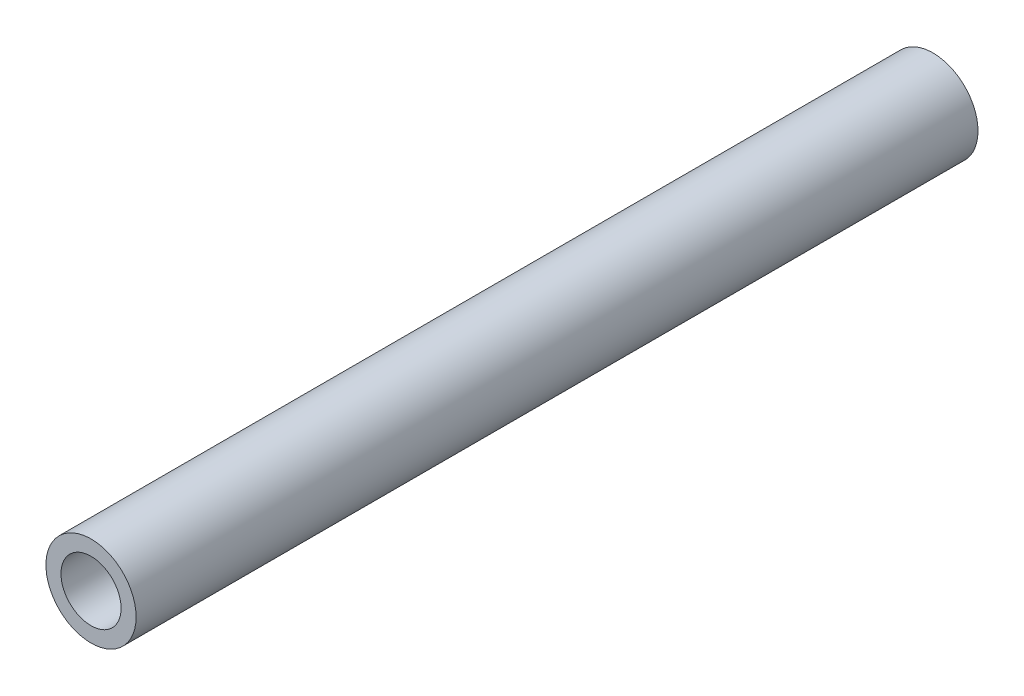
from build123d import *

# Parameters (mm, degrees)
SKETCH1_R           = 15
SKETCH1_R_2         = 10
BOSS_EXTRUDE1_DEPTH = 140


with BuildPart() as part:
    # Sketch1 → Boss-Extrude1 (new, symmetric)
    with BuildSketch(Plane(origin=(0, 0, 0), x_dir=(0, 1, 0), z_dir=(0, 0, 1))):
        with Locations(Location((0, 0, 0), (0, 0, 270))):
            Circle(SKETCH1_R)
        with Locations(Location((0, 0, 0), (0, 0, 270))):
            Circle(SKETCH1_R_2, mode=Mode.SUBTRACT)
    extrude(amount=BOSS_EXTRUDE1_DEPTH, both=True)


solid = part.part
